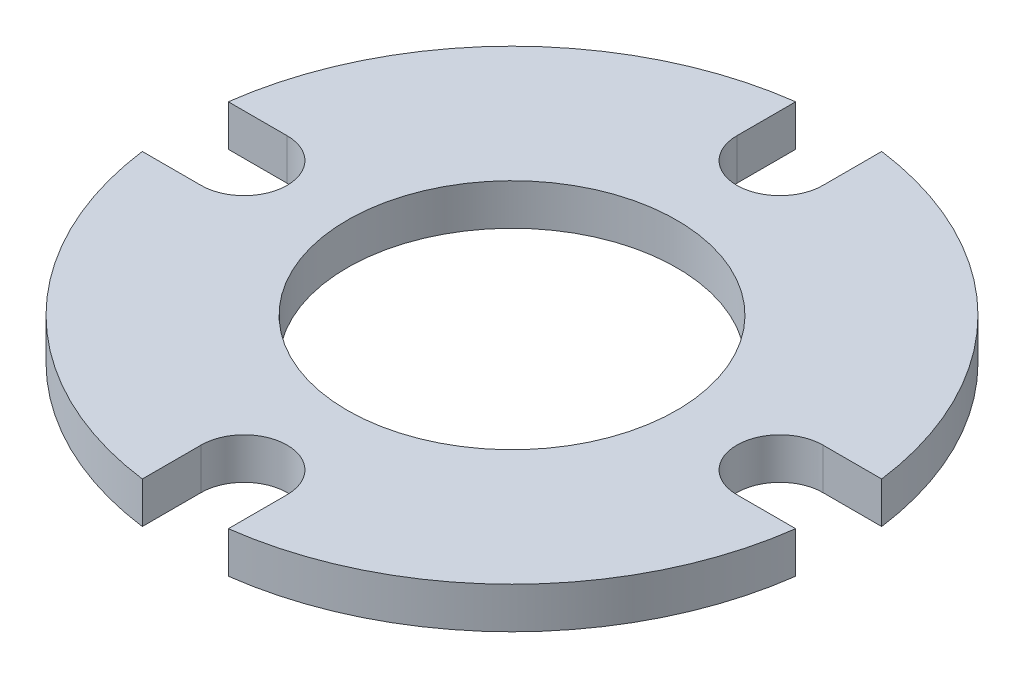
from build123d import *

# Parameters (mm, degrees)
SKETCH1_R           = 1
BOSS_EXTRUDE2_DEPTH = 0.125
CUT_EXTRUDE1_DEPTH  = 2.419727086
CIRPATTERN1_COUNT   = 4
SKETCH4_R           = 0.5
CUT_EXTRUDE2_DEPTH  = 2.40767025


with BuildPart() as part:
    # Sketch1 → Boss-Extrude2 (new body)
    with BuildSketch(Plane(origin=(0, 0, 0), x_dir=(1, 0, 0), z_dir=(0, 1, 0))):
        with Locations(Location((0, 0, 0), (0, 0, 270))):
            Circle(SKETCH1_R)
    extrude(amount=BOSS_EXTRUDE2_DEPTH)

    # Sketch3 → Cut-Extrude1 (cut, symmetric)
    with BuildSketch(Plane(origin=(0, 0.125, 0), x_dir=(1, 0, 0), z_dir=(0, 1, 0))):
        with BuildLine():
            Line((-0.130555483, 15.571394269), (-0.130555483, 0.991441005))
            Line((-0.130555483, 0.991441005), (-0.130555483, 0.813))
            ThreePointArc((-0.130555483, 0.813), (0, 0.682444517), (0.130555483, 0.813))
            Line((0.130555483, 0.813), (0.130555483, 0.991441005))
            Line((0.130555483, 0.991441005), (0.130555483, 15.571394269))
            Line((0.130555483, 15.571394269), (0.130555483, 44.731300798))
            Line((0.130555483, 44.731300798), (-0.130555483, 44.731300798))
            Line((-0.130555483, 44.731300798), (-0.130555483, 15.571394269))
        make_face()
    cut_extrude1 = extrude(amount=CUT_EXTRUDE1_DEPTH, both=True, mode=Mode.SUBTRACT)

    # CirPattern1: Cut-Extrude1 ×4 about axis
    cirpattern1_axis = Axis((0, 0, 0), (0, 1, 0))
    for i in range(1, CIRPATTERN1_COUNT):
        add(cut_extrude1.rotate(cirpattern1_axis, i * 360 / CIRPATTERN1_COUNT), mode=Mode.SUBTRACT)

    # Sketch4 → Cut-Extrude2 (cut, through all)
    with BuildSketch(Plane(origin=(0, 0.125, 0), x_dir=(1, 0, 0), z_dir=(0, 1, 0))):
        with Locations(Location((0, 0, 0), (0, 0, 270))):
            Circle(SKETCH4_R)
    extrude(amount=-CUT_EXTRUDE2_DEPTH, mode=Mode.SUBTRACT)


solid = part.part
